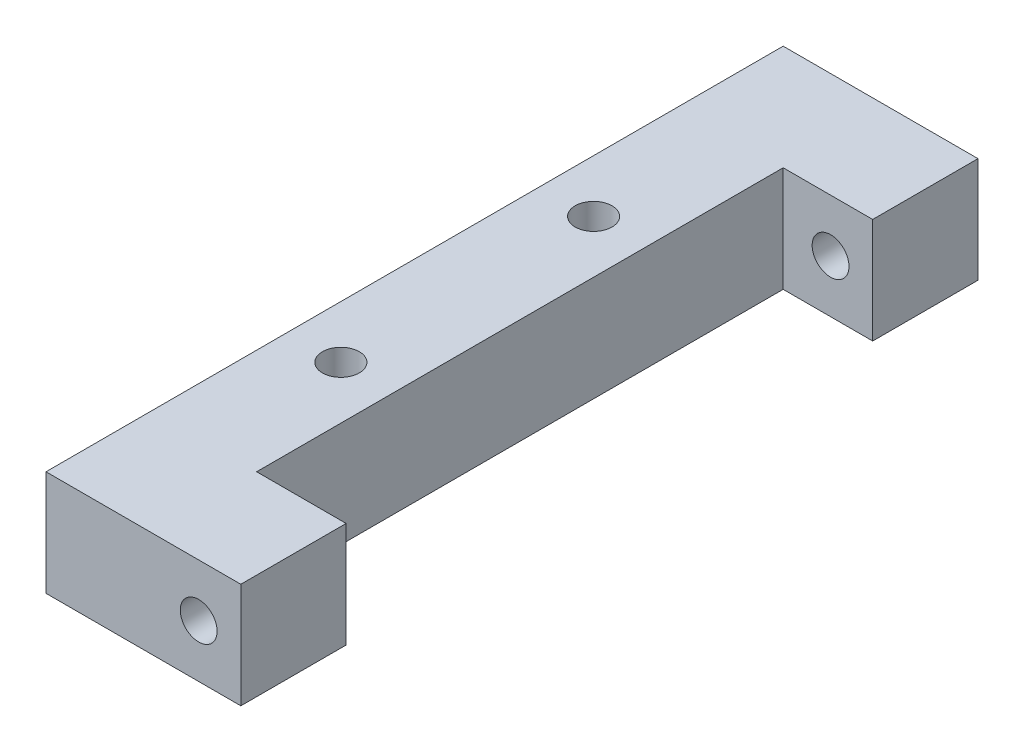
from build123d import *

# Parameters (mm, degrees)
SKETCH1_W           = 18.5
SKETCH1_H           = 10
BOSS_EXTRUDE1_DEPTH = 10
SKETCH2_W           = 10
SKETCH2_H           = 10
BOSS_EXTRUDE2_DEPTH = 50
SKETCH3_W           = 18.5
SKETCH3_H           = 10
BOSS_EXTRUDE3_DEPTH = 10
SKETCH4_R           = 1.75
CUT_EXTRUDE1_DEPTH  = 71.785326869
SKETCH5_R           = 1.75
CUT_EXTRUDE2_DEPTH  = 72.313129927


with BuildPart() as part:
    # Sketch1 → Boss-Extrude1 (new body)
    with BuildSketch(Plane.XY):
        Rectangle(SKETCH1_W, SKETCH1_H)
    extrude(amount=BOSS_EXTRUDE1_DEPTH)

    # Sketch2 → Boss-Extrude2 (add)
    with BuildSketch(Plane.XY.offset(10)):
        with Locations((-4.25, 0)):
            Rectangle(SKETCH2_W, SKETCH2_H)
    extrude(amount=BOSS_EXTRUDE2_DEPTH)

    # Sketch3 → Boss-Extrude3 (add)
    with BuildSketch(Plane.XY.offset(60)):
        Rectangle(SKETCH3_W, SKETCH3_H)
    extrude(amount=BOSS_EXTRUDE3_DEPTH)

    # Sketch4 → Cut-Extrude1 (cut, through all)
    with BuildSketch(Plane.XY.offset(70)):
        with Locations((5.25, 0)):
            Circle(SKETCH4_R)
    extrude(amount=-CUT_EXTRUDE1_DEPTH, mode=Mode.SUBTRACT)

    # Sketch5 → Cut-Extrude2 (cut, through all)
    with BuildSketch(Plane(origin=(0, 5, 0), x_dir=(1, 0, 0), z_dir=(0, 1, 0))):
        with Locations(Location((-4.25, -23, 0), (0, 0, 270))):
            Circle(SKETCH5_R)
        with Locations(Location((-4.25, -47, 0), (0, 0, 270))):
            Circle(SKETCH5_R)
    extrude(amount=-CUT_EXTRUDE2_DEPTH, mode=Mode.SUBTRACT)


solid = part.part
